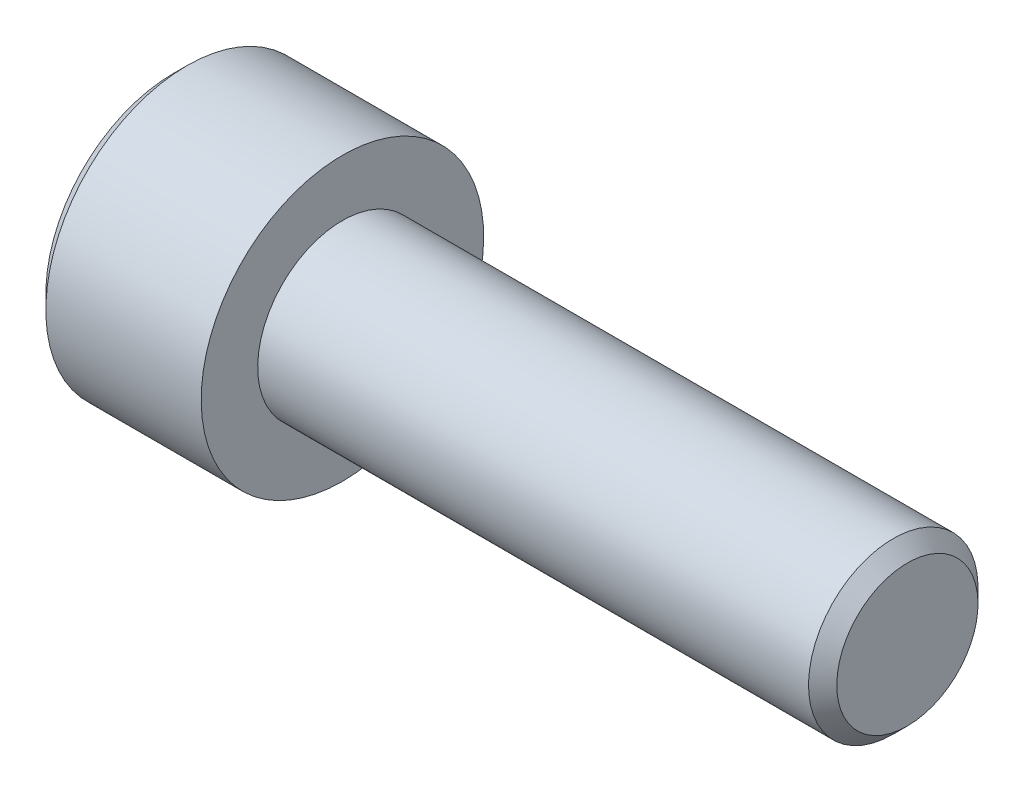
from build123d import *

# Parameters (mm, degrees)
CUT_EXTRUDE1_DEPTH = 3
CHAMFER1_SIZE      = 0.5


with BuildPart() as part:
    # Sketch1 → Revolve1 (revolve)
    with BuildSketch(Plane.XY, mode=Mode.PRIVATE) as revolve1_sk:
        Polygon((-6, 0), (-6, 5), (0, 5), (0, 3), (20, 3), (20, 0), align=None)
    revolve(revolve1_sk.sketch.rotate(Axis((20, 0, 0), (-1, 0, 0)), 180), axis=Axis((20, 0, 0), (-1, 0, 0)))

    # Sketch2 → Cut-Revolve1 (revolve, cut)
    with BuildSketch(Plane.XY, mode=Mode.PRIVATE) as cut_revolve1_sk:
        Polygon((-6, 0), (-6, 2.495), (-3, 2.495), (-2.331466765, 0), align=None)
    revolve(cut_revolve1_sk.sketch.rotate(Axis((-2.331466765, 0, 0), (-1, 0, 0)), 270), axis=Axis((-2.331466765, 0, 0), (-1, 0, 0)), mode=Mode.SUBTRACT)

    # Sketch3 → Cut-Extrude1 (cut)
    with BuildSketch(Plane.ZY.offset(6)):
        Polygon((0, 2.886751346), (-2.5, 1.443375673), (-2.5, -1.443375673), (0, -2.886751346), (2.5, -1.443375673), (2.5, 1.443375673), align=None)
    extrude(amount=-CUT_EXTRUDE1_DEPTH, mode=Mode.SUBTRACT)

    # Chamfer1
    chamfer1_edges = [part.edges().sort_by_distance(p)[0] for p in [
        (20, 3, 0),
        (-6, 5, 0),
    ]]
    chamfer(chamfer1_edges, length=CHAMFER1_SIZE)


solid = part.part
